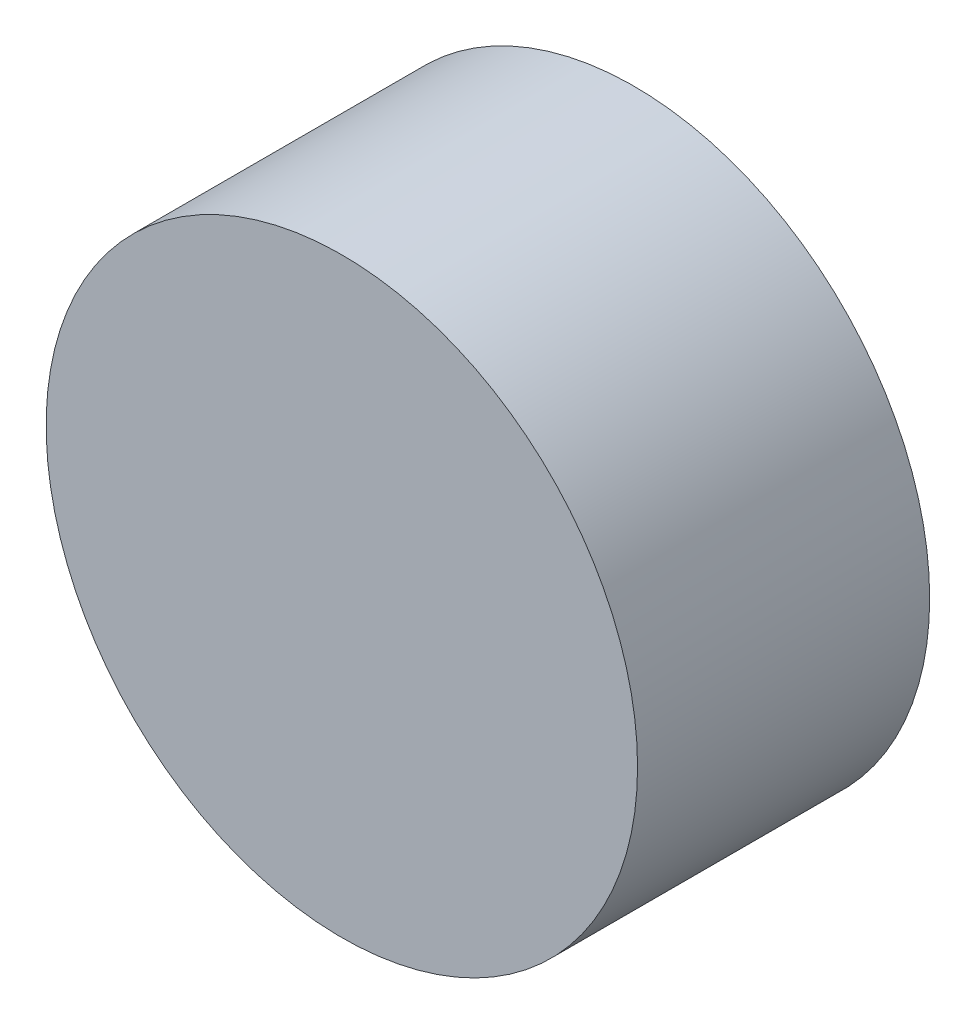
from build123d import *

# Parameters (mm, degrees)
SKETCH1_W = 10.123456789
SKETCH1_H = 10


with BuildPart() as part:
    # Sketch1 → Revolve1 (revolve)
    with BuildSketch(Plane(origin=(0, 0, 0), x_dir=(1, 0, 0), z_dir=(0, 1, 0))):
        with Locations((5.061728395, -5)):
            Rectangle(SKETCH1_W, SKETCH1_H)
    revolve(axis=Axis((0, 0, 0), (0, 0, 1)))


solid = part.part
